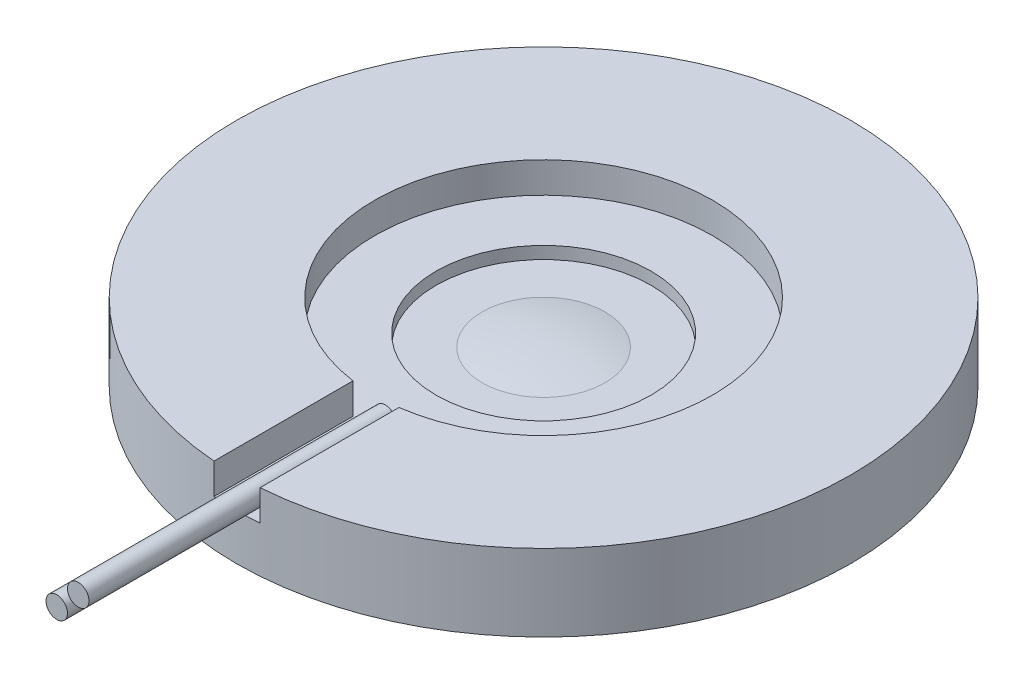
from build123d import *

# Parameters (mm, degrees)
SKETCH5_W           = 1.5
SKETCH5_H           = 6.361903522
CUT_EXTRUDE1_DEPTH  = 1
BOSS_EXTRUDE1_START = 5.5
SKETCH3_R           = 0.35
BOSS_EXTRUDE1_DEPTH = 10


with BuildPart() as part:
    # Sketch2 → Revolve1 (revolve)
    with BuildSketch(Plane.XY, mode=Mode.PRIVATE) as revolve1_sk:
        with BuildLine():
            Line((-1.989974874, 0), (-6, 0))
            Line((-6, 0), (-6, -1))
            Line((-6, -1), (-10, -1))
            Line((-10, -1), (-10, 1.5))
            Line((-10, 1.5), (-5.5, 1.5))
            Line((-5.5, 1.5), (-5.5, 0.5))
            Line((-5.5, 0.5), (-3.5, 0.5))
            Line((-3.5, 0.5), (-3.5, 0.1))
            Line((-3.5, 0.1), (-2, 0.1))
            ThreePointArc((-2, 0.1), (-1.004987562, 0.249875621), (0, 0.3))
            Line((0, 0.3), (0, 0.2))
            ThreePointArc((0, 0.2), (-1, 0.149874371), (-1.989974874, 0))
        make_face()
    revolve(revolve1_sk.sketch.rotate(Axis((0, -1.216210025, 0), (0, 1, 0)), 270), axis=Axis((0, -1.216210025, 0), (0, 1, 0)))

    # Sketch5 → Cut-Extrude1 (cut)
    with BuildSketch(Plane(origin=(0, 1.5, 0), x_dir=(1, 0, 0), z_dir=(0, 1, 0))):
        with Locations((-0.007942998, -7.408272411)):
            Rectangle(SKETCH5_W, SKETCH5_H)
    extrude(amount=-CUT_EXTRUDE1_DEPTH, mode=Mode.SUBTRACT)

    # Sketch3 → Boss-Extrude1 (add)
    with BuildSketch(Plane.XY.offset(BOSS_EXTRUDE1_START)):
        with Locations(Location((-0.35, 0.35, 0), (0, 0, 154.623066475))):
            Circle(SKETCH3_R)
        with Locations((0.35, 1.05)):
            Circle(SKETCH3_R)
    extrude(amount=BOSS_EXTRUDE1_DEPTH)


with BuildPart() as boss_extrude1_piece_1:
    # of the separate pieces the step leaves, piece 1, a body of its own (boss_extrude1_pieces)
    add(part.part.solids().sort_by_distance((0, 0.2, 0))[0])


with BuildPart() as boss_extrude1_piece_2:
    # of the separate pieces the step leaves, piece 2, a body of its own (boss_extrude1_pieces)
    add(part.part.solids().sort_by_distance((0.7, 1.05, 5.5))[0])


solid = Compound([boss_extrude1_piece_1.part, boss_extrude1_piece_2.part])
